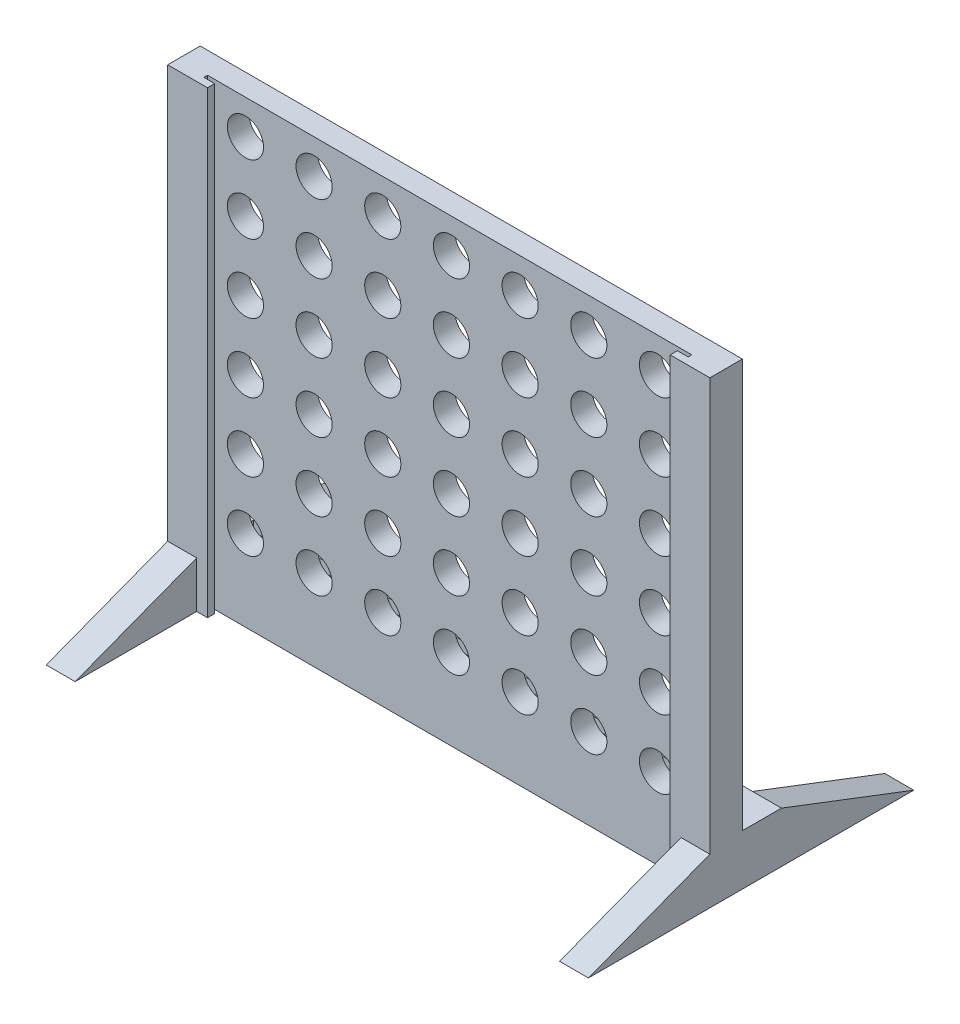
from build123d import *

# Parameters (mm, degrees)
SKETCH1_W           = 67
SKETCH1_H           = 56.5
SKETCH1_R           = 2.5
BOSS_EXTRUDE1_DEPTH = 3
BOSS_EXTRUDE2_DEPTH = 67
BOSS_EXTRUDE3_DEPTH = 4
BOSS_EXTRUDE4_DEPTH = 4
BOSS_EXTRUDE5_REACH = 79.461
SKETCH6_W           = 1.5
SKETCH6_H           = 1


with BuildPart() as part:
    # Sketch1 → Boss-Extrude1 (new body)
    with BuildSketch(Plane.XY):
        Rectangle(SKETCH1_W, SKETCH1_H)
        with Locations((-28.25, 23.5)):
            Circle(SKETCH1_R, mode=Mode.SUBTRACT)
        with Locations((-18.75, 23.5)):
            Circle(SKETCH1_R, mode=Mode.SUBTRACT)
        with Locations((-9.25, 23.5)):
            Circle(SKETCH1_R, mode=Mode.SUBTRACT)
        with Locations((0.25, 23.5)):
            Circle(SKETCH1_R, mode=Mode.SUBTRACT)
        with Locations((9.75, 23.5)):
            Circle(SKETCH1_R, mode=Mode.SUBTRACT)
        with Locations((19.25, 23.5)):
            Circle(SKETCH1_R, mode=Mode.SUBTRACT)
        with Locations((28.75, 23.5)):
            Circle(SKETCH1_R, mode=Mode.SUBTRACT)
        with Locations((-18.75, 14)):
            Circle(SKETCH1_R, mode=Mode.SUBTRACT)
        with Locations((-9.25, 14)):
            Circle(SKETCH1_R, mode=Mode.SUBTRACT)
        with Locations((0.25, 14)):
            Circle(SKETCH1_R, mode=Mode.SUBTRACT)
        with Locations((9.75, 14)):
            Circle(SKETCH1_R, mode=Mode.SUBTRACT)
        with Locations((19.25, 14)):
            Circle(SKETCH1_R, mode=Mode.SUBTRACT)
        with Locations((28.75, 14)):
            Circle(SKETCH1_R, mode=Mode.SUBTRACT)
        with Locations((-18.75, 4.5)):
            Circle(SKETCH1_R, mode=Mode.SUBTRACT)
        with Locations((-9.25, 4.5)):
            Circle(SKETCH1_R, mode=Mode.SUBTRACT)
        with Locations((0.25, 4.5)):
            Circle(SKETCH1_R, mode=Mode.SUBTRACT)
        with Locations((9.75, 4.5)):
            Circle(SKETCH1_R, mode=Mode.SUBTRACT)
        with Locations((19.25, 4.5)):
            Circle(SKETCH1_R, mode=Mode.SUBTRACT)
        with Locations((28.75, 4.5)):
            Circle(SKETCH1_R, mode=Mode.SUBTRACT)
        with Locations((-18.75, -5)):
            Circle(SKETCH1_R, mode=Mode.SUBTRACT)
        with Locations((-9.25, -5)):
            Circle(SKETCH1_R, mode=Mode.SUBTRACT)
        with Locations((0.25, -5)):
            Circle(SKETCH1_R, mode=Mode.SUBTRACT)
        with Locations((9.75, -5)):
            Circle(SKETCH1_R, mode=Mode.SUBTRACT)
        with Locations((19.25, -5)):
            Circle(SKETCH1_R, mode=Mode.SUBTRACT)
        with Locations((28.75, -5)):
            Circle(SKETCH1_R, mode=Mode.SUBTRACT)
        with Locations((-18.75, -14.5)):
            Circle(SKETCH1_R, mode=Mode.SUBTRACT)
        with Locations((-9.25, -14.5)):
            Circle(SKETCH1_R, mode=Mode.SUBTRACT)
        with Locations((0.25, -14.5)):
            Circle(SKETCH1_R, mode=Mode.SUBTRACT)
        with Locations((9.75, -14.5)):
            Circle(SKETCH1_R, mode=Mode.SUBTRACT)
        with Locations((19.25, -14.5)):
            Circle(SKETCH1_R, mode=Mode.SUBTRACT)
        with Locations((28.75, -14.5)):
            Circle(SKETCH1_R, mode=Mode.SUBTRACT)
        with Locations((-18.75, -24)):
            Circle(SKETCH1_R, mode=Mode.SUBTRACT)
        with Locations((-9.25, -24)):
            Circle(SKETCH1_R, mode=Mode.SUBTRACT)
        with Locations((0.25, -24)):
            Circle(SKETCH1_R, mode=Mode.SUBTRACT)
        with Locations((9.75, -24)):
            Circle(SKETCH1_R, mode=Mode.SUBTRACT)
        with Locations((19.25, -24)):
            Circle(SKETCH1_R, mode=Mode.SUBTRACT)
        with Locations((28.75, -24)):
            Circle(SKETCH1_R, mode=Mode.SUBTRACT)
        with Locations((-28.25, 14)):
            Circle(SKETCH1_R, mode=Mode.SUBTRACT)
        with Locations((-28.25, 4.5)):
            Circle(SKETCH1_R, mode=Mode.SUBTRACT)
        with Locations((-28.25, -5)):
            Circle(SKETCH1_R, mode=Mode.SUBTRACT)
        with Locations((-28.25, -14.5)):
            Circle(SKETCH1_R, mode=Mode.SUBTRACT)
        with Locations((-28.25, -24)):
            Circle(SKETCH1_R, mode=Mode.SUBTRACT)
    extrude(amount=BOSS_EXTRUDE1_DEPTH)

    # Sketch2 → Boss-Extrude2 (add)
    with BuildSketch(Plane(origin=(33.5, 0, 0), x_dir=(0, 0, -1), z_dir=(1, 0, 0))):
        Polygon((0, -28.25), (-3, -28.25), (-3, -35.25), (5.4, -35.25), (5.4, -28.25), (3.4, -28.25), (3.4, -33.25), (2, -33.25), (2, -28.25), align=None)
    extrude(amount=-BOSS_EXTRUDE2_DEPTH)

    # Sketch3 → Boss-Extrude3 (add)
    with BuildSketch(Plane.ZY.offset(33.5)):
        Polygon((-5.4, -28.25), (-23.7, -35.25), (21.3, -35.25), (3, -28.25), align=None)
    extrude(amount=BOSS_EXTRUDE3_DEPTH)

    # Sketch4 → Boss-Extrude4 (add)
    with BuildSketch(Plane(origin=(33.5, 0, 0), x_dir=(0, 0, -1), z_dir=(1, 0, 0))):
        Polygon((5.4, -28.25), (23.7, -35.25), (-21.3, -35.25), (-3, -28.25), align=None)
    extrude(amount=BOSS_EXTRUDE4_DEPTH)

    # Boss-Extrude5: up to this face of the body (flat: up to its plane)
    boss_extrude5_end = Plane(part.part.faces().sort_by_distance((0, 28.25, 1.5))[0])
    # Sketch6 → Boss-Extrude5 (add, up to the picked face)
    with BuildSketch(Plane.XZ.offset(35.25), mode=Mode.PRIVATE) as boss_extrude5_sk1:
        Polygon((-33.5, 3), (-33.5, 3.5), (-33.5, 4.5), (-37.5, 4.5), (-37.5, 0), (-33.5, 0), align=None)
    boss_extrude5_tool1 = split(extrude(boss_extrude5_sk1.sketch, amount=-BOSS_EXTRUDE5_REACH, mode=Mode.PRIVATE), bisect_by=boss_extrude5_end, keep=Keep.BOTH, mode=Mode.PRIVATE)
    # Sketch6 → Boss-Extrude5 (add, up to the picked face)
    with BuildSketch(Plane.XZ.offset(35.25), mode=Mode.PRIVATE) as boss_extrude5_sk2:
        with Locations((-32.75, 4)):
            Rectangle(SKETCH6_W, SKETCH6_H)
    boss_extrude5_tool2 = split(extrude(boss_extrude5_sk2.sketch, amount=-BOSS_EXTRUDE5_REACH, mode=Mode.PRIVATE), bisect_by=boss_extrude5_end, keep=Keep.BOTH, mode=Mode.PRIVATE)
    # Sketch6 → Boss-Extrude5 (add, up to the picked face)
    with BuildSketch(Plane.XZ.offset(35.25), mode=Mode.PRIVATE) as boss_extrude5_sk3:
        Polygon((33.5, 4.5), (33.5, 3.5), (33.5, 3), (33.5, 0), (37.5, 0), (37.5, 4.5), align=None)
    boss_extrude5_tool3 = split(extrude(boss_extrude5_sk3.sketch, amount=-BOSS_EXTRUDE5_REACH, mode=Mode.PRIVATE), bisect_by=boss_extrude5_end, keep=Keep.BOTH, mode=Mode.PRIVATE)
    # Sketch6 → Boss-Extrude5 (add, up to the picked face)
    with BuildSketch(Plane.XZ.offset(35.25), mode=Mode.PRIVATE) as boss_extrude5_sk4:
        with Locations((32.75, 4)):
            Rectangle(SKETCH6_W, SKETCH6_H)
    boss_extrude5_tool4 = split(extrude(boss_extrude5_sk4.sketch, amount=-BOSS_EXTRUDE5_REACH, mode=Mode.PRIVATE), bisect_by=boss_extrude5_end, keep=Keep.BOTH, mode=Mode.PRIVATE)
    add(boss_extrude5_tool1.solids().sort_by(Axis((-35.5, -35.25, 2.25), (0, 1, 0)))[0])
    add(boss_extrude5_tool2.solids().sort_by(Axis((-32.75, -35.25, 4), (0, 1, 0)))[0])
    add(boss_extrude5_tool3.solids().sort_by(Axis((35.5, -35.25, 2.25), (0, 1, 0)))[0])
    add(boss_extrude5_tool4.solids().sort_by(Axis((32.75, -35.25, 4), (0, 1, 0)))[0])


solid = part.part
